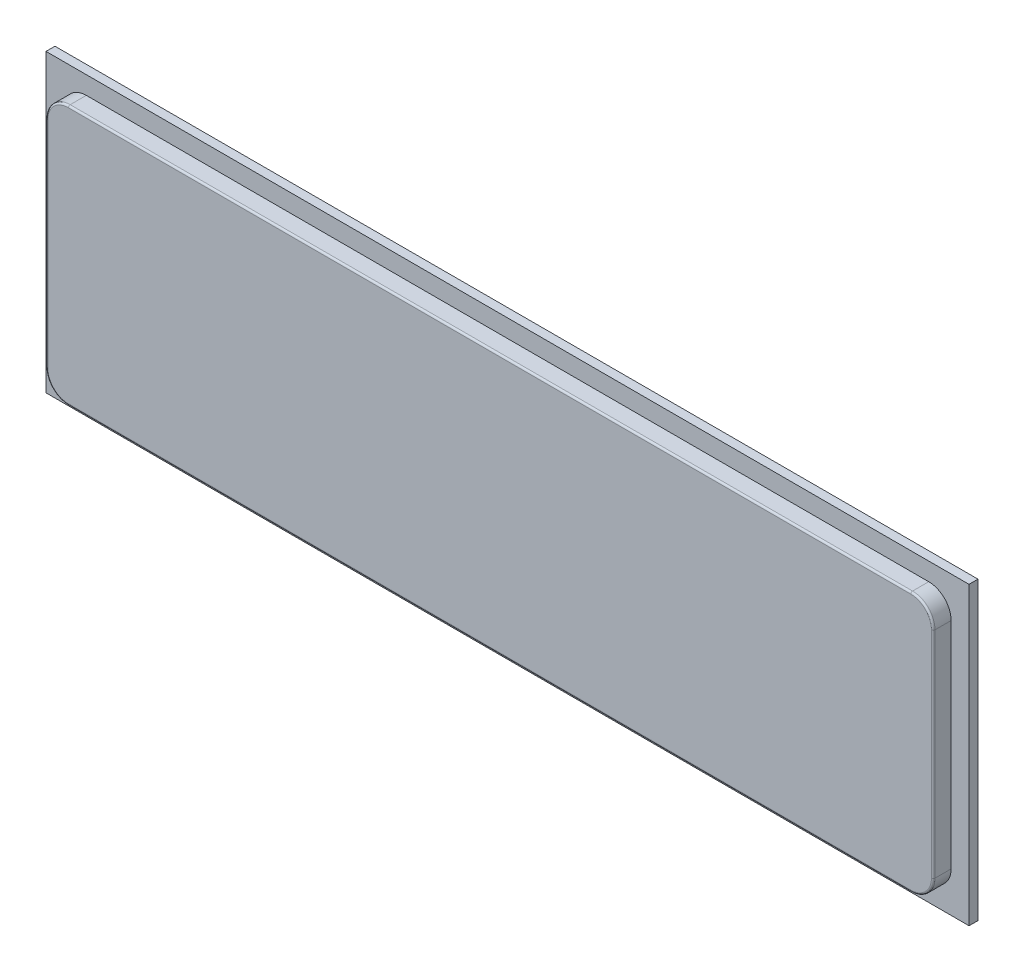
from build123d import *

# Parameters (mm, degrees)
SKETCH_1_W      = 99
SKETCH_1_H      = 29
EXTRUDE_2_DEPTH = 2
FILLET_1_R      = 2.5
SKETCH_3_W      = 103
SKETCH_3_H      = 33
EXTRUDE_3_DEPTH = 1
FILLET_2_R      = 0.2


with BuildPart() as part:
    # Эскиз1 → Бобышка-Вытянуть2 (new body)
    with BuildSketch(Plane.XY):
        with Locations((-70, 10)):
            Rectangle(SKETCH_1_W, SKETCH_1_H)
    extrude(amount=-EXTRUDE_2_DEPTH)

    # Скругление1
    fillet_1_edges = [part.edges().sort_by_distance(p)[0] for p in [
        (-119.5, 24.5, -1),
        (-20.5, 24.5, -1),
        (-20.5, -4.5, -1),
        (-119.5, -4.5, -1),
    ]]
    fillet(fillet_1_edges, radius=FILLET_1_R)

    # Эскиз3 → Бобышка-Вытянуть3 (add)
    with BuildSketch(Plane.XY.offset(-2)):
        with Locations((-70, 10)):
            Rectangle(SKETCH_3_W, SKETCH_3_H)
    extrude(amount=-EXTRUDE_3_DEPTH)

    # Скругление2
    fillet_2_edges = [part.edges().sort_by_distance(p)[0] for p in [
        (-70, -4.5, 0),
        (-119.5, 10, 0),
        (-20.5, 10, 0),
        (-70, 24.5, 0),
        (-21.232233047, 23.767766953, 0),
        (-118.767766953, 23.767766953, 0),
        (-118.767766953, -3.767766953, 0),
        (-21.232233047, -3.767766953, 0),
    ]]
    fillet(fillet_2_edges, radius=FILLET_2_R)


solid = part.part
